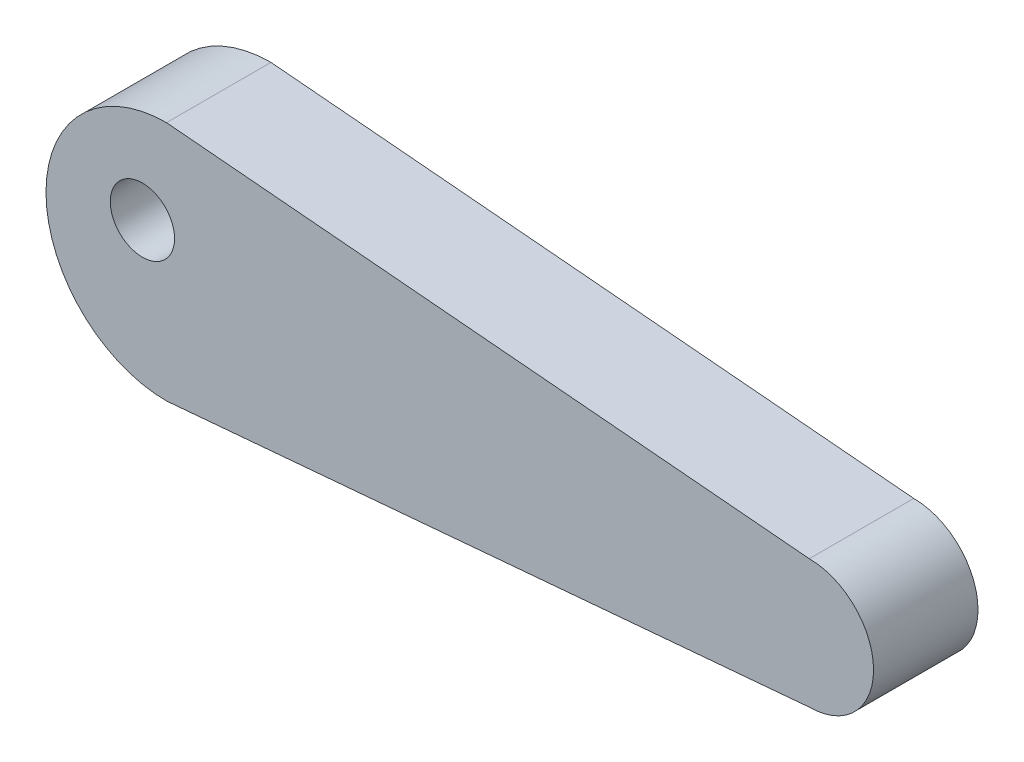
from build123d import *

# Parameters (mm, degrees)
BOSS_EXTRU_1_DEPTH           = 13
ENL_V_MAT_EXTRU_1_DEPTH      = 91.210864091
ENL_V_MAT_EXTRU_1_DEPTH_BACK = 91.210864091
ESQUISSE2_R                  = 4


with BuildPart() as part:
    # Esquisse1 → Boss.-Extru.1 (new body)
    with BuildSketch(Plane.XY):
        with BuildLine():
            Line((0, 15), (80, 8))
            ThreePointArc((80, 8), (88, 0), (80, -8))
            Line((80, -8), (0, -15))
            ThreePointArc((0, -15), (-15, 0), (0, 15))
        make_face()
    extrude(amount=BOSS_EXTRU_1_DEPTH)

    # Esquisse2 → Enlèv. mat.-Extru.1 (cut, two sides: drawn at the far end of the back side and taken through both)
    with BuildSketch(Plane.XY.offset(13).offset(-ENL_V_MAT_EXTRU_1_DEPTH_BACK)):
        with Locations((-3, 3)):
            Circle(ESQUISSE2_R)
    extrude(amount=ENL_V_MAT_EXTRU_1_DEPTH + ENL_V_MAT_EXTRU_1_DEPTH_BACK, mode=Mode.SUBTRACT)


solid = part.part
